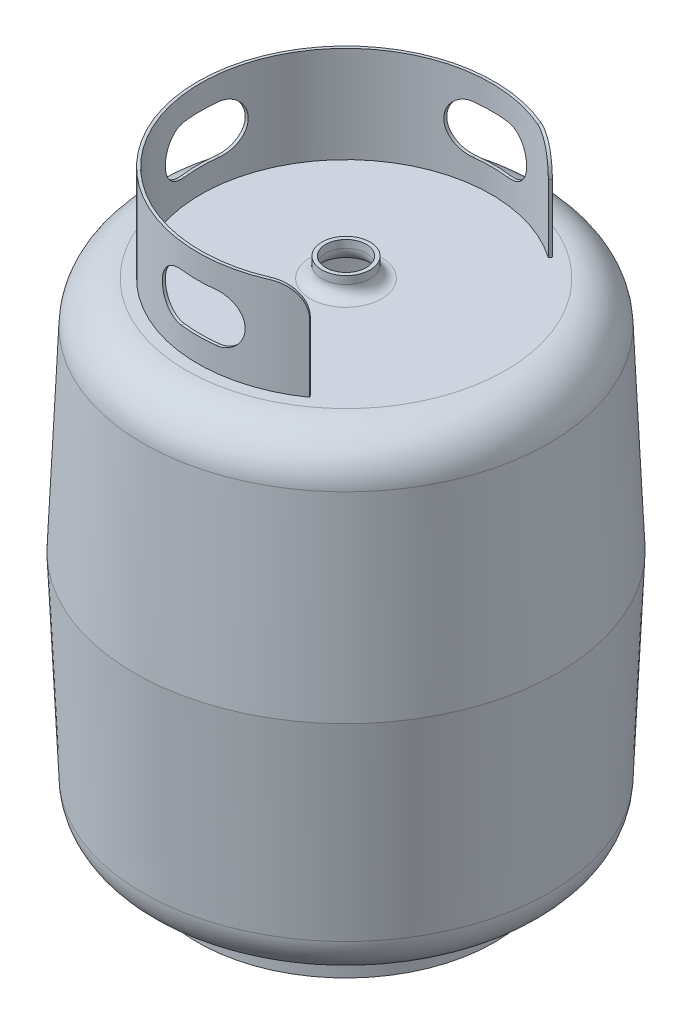
from build123d import *

# Parameters (mm, degrees)
SKETCH3_R           = 153.671871599
SKETCH3_R_2         = 150.671871599
BOSS_EXTRUDE1_DEPTH = 30
BOSS_EXTRUDE2_START = 100
BOSS_EXTRUDE2_DEPTH = 100
CUT_EXTRUDE1_DEPTH  = 667.643766236
CIRPATTERN1_COUNT   = 4
FILLET1_R           = 30


with BuildPart() as part:
    # Sketch1 → Revolve1 (revolve)
    with BuildSketch(Plane.XY):
        with BuildLine():
            Line((0, 0), (165.671871599, 0))
            ThreePointArc((165.671871599, 0), (196.789959109, 12.493621707), (210.62904157, 43.037127569))
            Line((210.62904157, 43.037127569), (219.446931013, 245))
            Line((219.446931013, 245), (210.62904157, 446.962872431))
            ThreePointArc((210.62904157, 446.962872431), (196.789959109, 477.506378293), (165.671871599, 490))
            Line((165.671871599, 490), (37, 490))
            ThreePointArc((37, 490), (28.514718626, 493.514718626), (25, 502))
            Line((25, 502), (25, 510))
            Line((25, 510), (21, 510))
            Line((21, 510), (21, 502))
            ThreePointArc((21, 502), (25.686291501, 490.686291501), (37, 486))
            Line((37, 486), (165.671871599, 486))
            ThreePointArc((165.671871599, 486), (194.023906886, 474.616922444), (206.632848683, 446.788394882))
            Line((206.632848683, 446.788394882), (215.443120272, 245))
            Line((215.443120272, 245), (206.632848683, 43.211605118))
            ThreePointArc((206.632848683, 43.211605118), (194.023906886, 15.383077556), (165.671871599, 4))
            Line((165.671871599, 4), (0, 4))
            Line((0, 4), (0, 0))
        make_face()
    revolve(axis=Axis((0, -5395.196891383, 0), (0, 1, 0)))

    # Sketch3 → Boss-Extrude1 (add)
    with BuildSketch(Plane.XZ):
        Circle(SKETCH3_R)
        Circle(SKETCH3_R_2, mode=Mode.SUBTRACT)
    extrude(amount=BOSS_EXTRUDE1_DEPTH)

    # Sketch4 → Boss-Extrude2 (add)
    with BuildSketch(Plane(origin=(0, 490, 0), x_dir=(1, 0, 0), z_dir=(0, 1, 0)).offset(BOSS_EXTRUDE2_START)):
        with BuildLine():
            Line((88.142564479, 125.88062777), (86.42183517, 123.423171637))
            ThreePointArc((86.42183517, 123.423171637), (-150.671871599, 0), (86.42183517, -123.423171637))
            Line((86.42183517, -123.423171637), (88.142564479, -125.88062777))
            ThreePointArc((88.142564479, -125.88062777), (-153.671871599, 0), (88.142564479, 125.88062777))
        make_face()
    extrude(amount=-BOSS_EXTRUDE2_DEPTH)

    # Sketch5 → Cut-Extrude1 (cut, through all)
    with BuildSketch(Plane.XY):
        with BuildLine():
            Line((-18, 565), (18, 565))
            ThreePointArc((18, 565), (43, 540), (18, 515))
            Line((18, 515), (-18, 515))
            ThreePointArc((-18, 515), (-43, 540), (-18, 565))
        make_face()
    cut_extrude1 = extrude(amount=-CUT_EXTRUDE1_DEPTH, mode=Mode.SUBTRACT)

    # CirPattern1: Cut-Extrude1 ×4 about axis
    cirpattern1_axis = Axis((0, 245, 0), (0, -1, 0))
    for i in range(1, CIRPATTERN1_COUNT):
        add(cut_extrude1.rotate(cirpattern1_axis, i * 360 / CIRPATTERN1_COUNT), mode=Mode.SUBTRACT)

    # Fillet1
    fillet1_edges = [part.edges().sort_by_distance(p)[0] for p in [
        (87.282199824, 590, -124.651899703),
        (87.282199824, 590, 124.651899703),
    ]]
    fillet(fillet1_edges, radius=FILLET1_R)


solid = part.part
